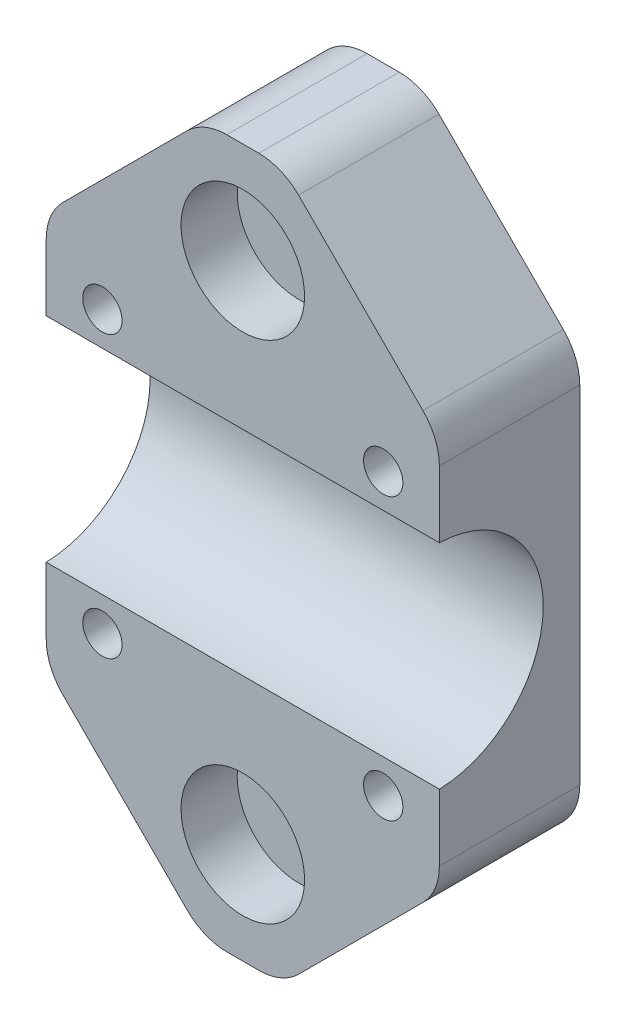
from build123d import *

# Parameters (mm, degrees)
BOSS_EXTRUDE1_DEPTH = 12.5
CUT_EXTRUDE1_REACH  = 50.719
SKETCH3_R           = 3
CUT_EXTRUDE2_DEPTH  = 3
SKETCH4_R           = 5.5
CUT_EXTRUDE3_DEPTH  = 5
FILLET1_R           = 5
SKETCH5_R           = 1.75
CUT_EXTRUDE4_DEPTH  = 9.1


with BuildPart() as part:
    # Sketch1 → Boss-Extrude1 (new body)
    with BuildSketch(Plane.XY):
        Polygon((-3.5, 31.5), (-17.5, 17.5), (-17.5, -17.5), (-3.5, -31.5), (3.5, -31.5), (17.5, -17.5), (17.5, 17.5), (3.5, 31.5), align=None)
    extrude(amount=BOSS_EXTRUDE1_DEPTH)

    # Sketch2 → Cut-Extrude1 (cut, up to next)
    with BuildSketch(Plane(origin=(17.5, 0, 0), x_dir=(0, 0, -1), z_dir=(1, 0, 0)), mode=Mode.PRIVATE) as cut_extrude1_sk1:
        with BuildLine():
            Line((-12.5, -9.496709957), (-12.5, 9.496709957))
            ThreePointArc((-12.5, 9.496709957), (-3.25, 0), (-12.5, -9.496709957))
        make_face()
    cut_extrude1_tool1 = extrude(cut_extrude1_sk1.sketch, amount=-CUT_EXTRUDE1_REACH, mode=Mode.PRIVATE) & part.part
    add(cut_extrude1_tool1.solids().sort_by_distance((17.5, 0, 8.582646))[0], mode=Mode.SUBTRACT)

    # Sketch3 → Cut-Extrude2 (cut)
    with BuildSketch(Plane(origin=(0, 0, 0), x_dir=(-1, 0, 0), z_dir=(0, 0, -1))):
        with Locations((-12.5, 12.5)):
            Circle(SKETCH3_R)
        with Locations(Location((12.5, 12.5, 0), (0, 0, 180))):
            Circle(SKETCH3_R)
        with Locations((12.5, -12.5)):
            Circle(SKETCH3_R)
        with Locations(Location((-12.5, -12.5, 0), (0, 0, 180))):
            Circle(SKETCH3_R)
    extrude(amount=-CUT_EXTRUDE2_DEPTH, mode=Mode.SUBTRACT)

    # Sketch4 → Cut-Extrude3 (cut)
    with BuildSketch(Plane.XY.offset(12.5)):
        with Locations((0, 22.5)):
            Circle(SKETCH4_R)
        with Locations(Location((0, -22.5, 0), (0, 0, 180))):
            Circle(SKETCH4_R)
    extrude(amount=-CUT_EXTRUDE3_DEPTH, mode=Mode.SUBTRACT)

    # Fillet1
    fillet1_edges = [part.edges().sort_by_distance(p)[0] for p in [
        (3.5, 31.5, 6.25),
        (17.5, 17.5, 6.25),
        (17.5, -17.5, 6.25),
        (3.5, -31.5, 6.25),
        (-3.5, -31.5, 6.25),
        (-17.5, -17.5, 6.25),
        (-17.5, 17.5, 6.25),
        (-3.5, 31.5, 6.25),
    ]]
    fillet(fillet1_edges, radius=FILLET1_R)

    # Sketch5 → Cut-Extrude4 (cut)
    with BuildSketch(Plane.XY.offset(12.5)):
        with Locations((-12.5, 12.5)):
            Circle(SKETCH5_R)
        with Locations(Location((12.5, 12.5, 0), (0, 0, 180))):
            Circle(SKETCH5_R)
        with Locations((12.5, -12.5)):
            Circle(SKETCH5_R)
        with Locations(Location((-12.5, -12.5, 0), (0, 0, 180))):
            Circle(SKETCH5_R)
    extrude(amount=-CUT_EXTRUDE4_DEPTH, mode=Mode.SUBTRACT)


solid = part.part
